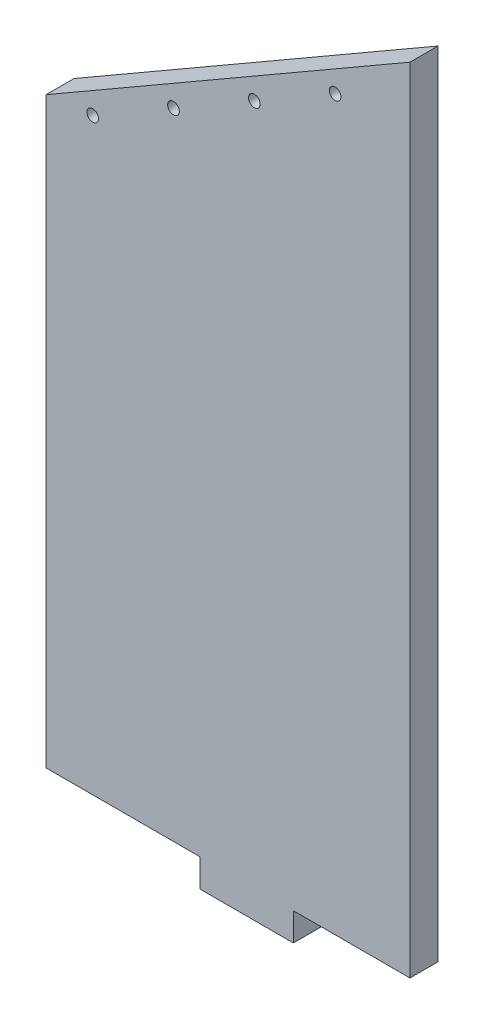
from build123d import *

# Parameters (mm, degrees)
BOSS_EXTRU_1_DEPTH      = 6
ESQUISSE2_R             = 1.25
ENL_V_MAT_EXTRU_1_DEPTH = 10
ESQUISSE4_W             = 20
ESQUISSE4_H             = 6
BOSS_EXTRU_2_DEPTH      = 6


with BuildPart() as part:
    # Esquisse1 → Boss.-Extru.1 (new body)
    with BuildSketch(Plane.XY):
        Polygon((-78, 0), (-78, 124.966679003), (0, 170), (0, 0), align=None)
    extrude(amount=BOSS_EXTRU_1_DEPTH)

    # Esquisse2 → Enlèv. mat.-Extru.1 (cut)
    with BuildSketch(Plane.XY.offset(6)):
        with Locations((-68, 126.121379542)):
            Circle(ESQUISSE2_R)
        with Locations((-50.679491924, 136.121379542)):
            Circle(ESQUISSE2_R)
        with Locations((-16.038475773, 156.121379542)):
            Circle(ESQUISSE2_R)
        with Locations((-33.358983849, 146.121379542)):
            Circle(ESQUISSE2_R)
    extrude(amount=-ENL_V_MAT_EXTRU_1_DEPTH, mode=Mode.SUBTRACT)

    # Esquisse4 → Boss.-Extru.2 (add)
    with BuildSketch(Plane.XZ):
        with Locations((-35, 3)):
            Rectangle(ESQUISSE4_W, ESQUISSE4_H)
    extrude(amount=BOSS_EXTRU_2_DEPTH)


solid = part.part
